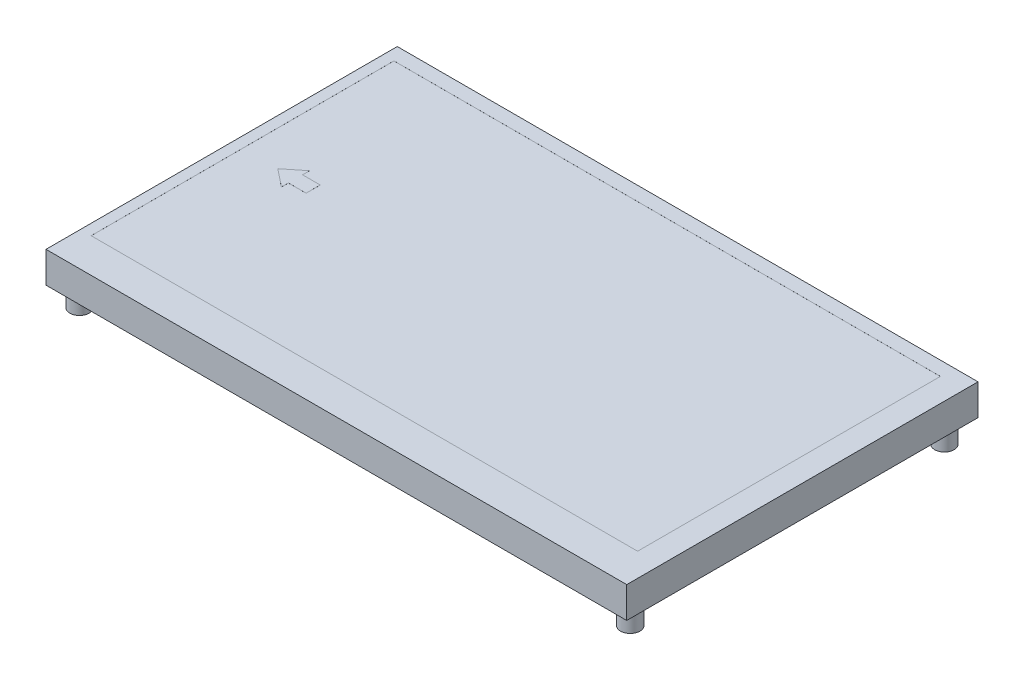
from build123d import *

# Parameters (mm, degrees)
SKETCH1_W           = 164.5
SKETCH1_H           = 99.5
BOSS_EXTRUDE1_DEPTH = 8.8
SKETCH2_R           = 2.75
SKETCH2_R_2         = 1.25
BOSS_EXTRUDE2_DEPTH = 6
SKETCH3_W           = 154.79
SKETCH3_H           = 85.77
CUT_EXTRUDE1_DEPTH  = 0.01
BOSS_EXTRUDE3_DEPTH = 7.3
SKETCH5_W           = 3.8
SKETCH5_H           = 3
BOSS_EXTRUDE4_DEPTH = 1.2


with BuildPart() as part:
    # Sketch1 → Boss-Extrude1 (new body)
    with BuildSketch(Plane(origin=(0, 0, 0), x_dir=(1, 0, 0), z_dir=(0, 1, 0))):
        Rectangle(SKETCH1_W, SKETCH1_H)
    extrude(amount=BOSS_EXTRUDE1_DEPTH)

    # Sketch2 → Boss-Extrude2 (add)
    # profile 1 of 4: a face of its own
    with BuildSketch(Plane.XZ):
        with Locations(Location((-78, 44.5, 0), (0, 0, 270))):
            Circle(SKETCH2_R)
        with Locations(Location((-78, 44.5, 0), (0, 0, 270))):
            Circle(SKETCH2_R_2, mode=Mode.SUBTRACT)
    # profile 2 of 4: a face of its own
    with BuildSketch(Plane.XZ):
        with Locations(Location((78, 44.5, 0), (0, 0, 90))):
            Circle(SKETCH2_R)
        with Locations(Location((78, 44.5, 0), (0, 0, 270))):
            Circle(SKETCH2_R_2, mode=Mode.SUBTRACT)
    # profile 3 of 4: a face of its own
    with BuildSketch(Plane.XZ):
        with Locations(Location((78, -44.5, 0), (0, 0, 270))):
            Circle(SKETCH2_R)
        with Locations(Location((78, -44.5, 0), (0, 0, 270))):
            Circle(SKETCH2_R_2, mode=Mode.SUBTRACT)
    # profile 4 of 4: a face of its own
    with BuildSketch(Plane.XZ):
        with Locations(Location((-78, -44.5, 0), (0, 0, 90))):
            Circle(SKETCH2_R)
        with Locations(Location((-78, -44.5, 0), (0, 0, 270))):
            Circle(SKETCH2_R_2, mode=Mode.SUBTRACT)
    extrude(amount=BOSS_EXTRUDE2_DEPTH)

    # Sketch3 → Cut-Extrude1 (cut)
    with BuildSketch(Plane(origin=(0, 8.8, 0), x_dir=(1, 0, 0), z_dir=(0, 1, 0))):
        with Locations((-1.795, 2.865)):
            Rectangle(SKETCH3_W, SKETCH3_H)
        Polygon((-64.19, -1.135), (-64.19, 0.865), (-59.19, 0.865), (-59.19, 4.865), (-64.19, 4.865), (-64.19, 6.865), (-69.19, 2.865), align=None, mode=Mode.SUBTRACT)
    extrude(amount=-CUT_EXTRUDE1_DEPTH, mode=Mode.SUBTRACT)

    # Sketch5 → Boss-Extrude4 (add)
    with BuildSketch(Plane.XZ):
        with Locations((-68, 46)):
            Rectangle(SKETCH5_W, SKETCH5_H)
        with Locations((68, 46)):
            Rectangle(SKETCH5_W, SKETCH5_H)
    extrude(amount=BOSS_EXTRUDE4_DEPTH)


with BuildPart() as body_2:
    # Sketch4 → Boss-Extrude3 (new body)
    with BuildSketch(Plane.ZY.offset(82.25)):
        with BuildLine():
            Line((31.85, -0.01), (37.75, -0.01))
            ThreePointArc((37.75, -0.01), (39.25, -1.51), (37.75, -3.01))
            Line((37.75, -3.01), (31.85, -3.01))
            ThreePointArc((31.85, -3.01), (30.35, -1.51), (31.85, -0.01))
        make_face()
        with BuildLine():
            Line((31.85, -0.16), (37.75, -0.16))
            ThreePointArc((37.75, -0.16), (39.1, -1.51), (37.75, -2.86))
            Line((37.75, -2.86), (31.85, -2.86))
            ThreePointArc((31.85, -2.86), (30.5, -1.51), (31.85, -0.16))
        make_face(mode=Mode.SUBTRACT)
    extrude(amount=-BOSS_EXTRUDE3_DEPTH)


solid = Compound([part.part, body_2.part])
